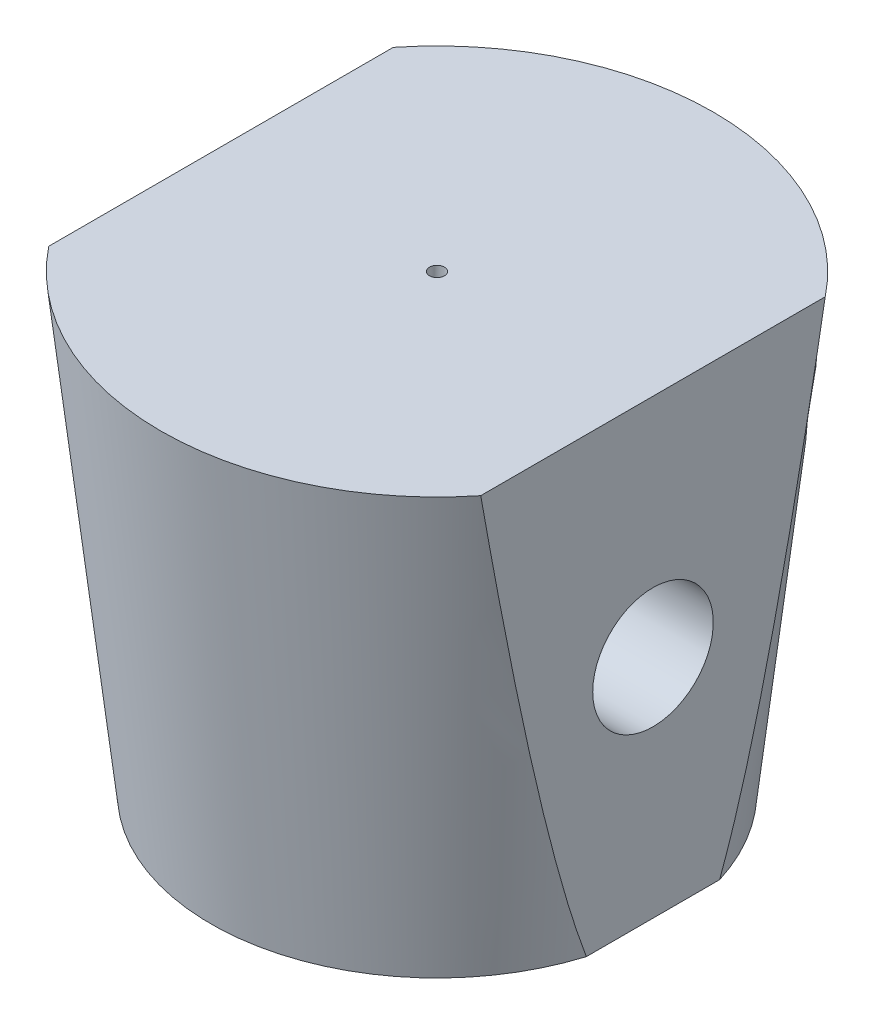
from build123d import *

# Parameters (mm, degrees)
SKIZZE2_R                            = 0.75
SCHNITT_LINEAR_AUSTRAGEN1_DEPTH      = 60.476886267
SKIZZE3_R                            = 3.5
SCHNITT_LINEAR_AUSTRAGEN2_DEPTH      = 25
SCHNITT_LINEAR_AUSTRAGEN3_DEPTH      = 60.476886267
SCHNITT_LINEAR_AUSTRAGEN3_DEPTH_BACK = 5
SKIZZE4_R                            = 6
SKIZZE5_W                            = 10
SKIZZE5_H                            = 60
SCHNITT_LINEAR_AUSTRAGEN4_DEPTH      = 60.476886435


with BuildPart() as part:
    # Skizze1 → Rotation1 (revolve)
    with BuildSketch(Plane.XY, mode=Mode.PRIVATE) as rotation1_sk:
        Polygon((0, 0), (-22.5, 0), (-27.5, 45), (0, 45), align=None)
    revolve(rotation1_sk.sketch.rotate(Axis((0, 0, 0), (0, 1, 0)), 270), axis=Axis((0, 0, 0), (0, 1, 0)))

    # Skizze2 → Schnitt-Linear austragen1 (cut, through all)
    with BuildSketch(Plane(origin=(0, 45, 0), x_dir=(1, 0, 0), z_dir=(0, 1, 0))):
        with Locations(Location((0, 0, 0), (0, 0, 270))):
            Circle(SKIZZE2_R)
    extrude(amount=-SCHNITT_LINEAR_AUSTRAGEN1_DEPTH, mode=Mode.SUBTRACT)

    # Skizze3 → Schnitt-Linear austragen2 (cut)
    with BuildSketch(Plane.XZ):
        with Locations(Location((0, 0, 0), (0, 0, 270))):
            Circle(SKIZZE3_R)
    extrude(amount=-SCHNITT_LINEAR_AUSTRAGEN2_DEPTH, mode=Mode.SUBTRACT)

    # Skizze4 → Schnitt-Linear austragen3 (cut, two sides: drawn at the far end of the back side and taken through both)
    with BuildSketch(Plane(origin=(0, 0, 0), x_dir=(0, 0, -1), z_dir=(1, 0, 0)).offset(-SCHNITT_LINEAR_AUSTRAGEN3_DEPTH_BACK)):
        with Locations(Location((0, 22.5, 0), (0, 0, 303.25844047))):
            Circle(SKIZZE4_R)
    extrude(amount=SCHNITT_LINEAR_AUSTRAGEN3_DEPTH + SCHNITT_LINEAR_AUSTRAGEN3_DEPTH_BACK, mode=Mode.SUBTRACT)

    # Skizze5 → Schnitt-Linear austragen4 (cut, through all)
    with BuildSketch(Plane(origin=(0, 45, 0), x_dir=(1, 0, 0), z_dir=(0, 1, 0))):
        with Locations((-26.5, 0)):
            Rectangle(SKIZZE5_W, SKIZZE5_H)
        with Locations((26.5, 0)):
            Rectangle(SKIZZE5_W, SKIZZE5_H)
    extrude(amount=-SCHNITT_LINEAR_AUSTRAGEN4_DEPTH, mode=Mode.SUBTRACT)


solid = part.part
